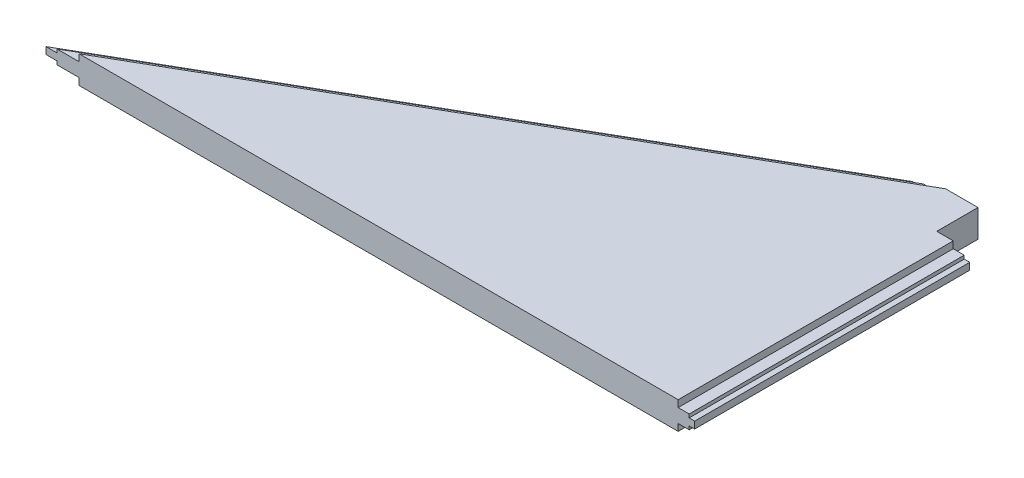
from build123d import *

# Parameters (mm, degrees)
BOSS_EXTRUDE1_DEPTH      = 6.35
BOSS_EXTRUDE1_DEPTH_BACK = 6.35
SKETCH2_W                = 292.995908675
SKETCH2_H                = 3.175
CUT_EXTRUDE1_DEPTH       = 38.1
SKETCH3_W                = 146.05
SKETCH3_H                = 3.175
CUT_EXTRUDE2_DEPTH       = 38.1
CUT_EXTRUDE3_DEPTH       = 3.175
CUT_EXTRUDE4_DEPTH       = 3.175
SKETCH6_W                = 5.08
SKETCH6_H                = 3.175
CUT_EXTRUDE5_DEPTH       = 157.099
CUT_EXTRUDE6_DEPTH       = 339.217
CUT_EXTRUDE6_DEPTH_BACK  = 157.099
SKETCH9_W                = 50.8
SKETCH9_H                = 19.05
CUT_EXTRUDE7_DEPTH       = 21.59


with BuildPart() as part:
    # Sketch1 → Boss-Extrude1 (new, two sides: drawn at the far end of the back side and taken through both)
    with BuildSketch(Plane(origin=(0, 0, 0), x_dir=(1, 0, 0), z_dir=(0, 1, 0)).offset(-BOSS_EXTRUDE1_DEPTH_BACK)):
        Polygon((-406.4, 0), (0, 0), (0, 146.05), (-152.4, 146.05), align=None)
    extrude(amount=BOSS_EXTRUDE1_DEPTH + BOSS_EXTRUDE1_DEPTH_BACK)

    # Sketch2 → Cut-Extrude1 (cut)
    with BuildSketch(Plane(origin=(-100.979614843, 0, -175.616721465), x_dir=(-0.8669063030575352, 0, 0.49847112425808277), z_dir=(-0.4984711242580827, 0, -0.8669063030575351))):
        with Locations((205.812767226, 4.7625)):
            Rectangle(SKETCH2_W, SKETCH2_H)
        with Locations((205.812767226, -4.7625)):
            Rectangle(SKETCH2_W, SKETCH2_H)
    extrude(amount=-CUT_EXTRUDE1_DEPTH, mode=Mode.SUBTRACT)

    # Sketch3 → Cut-Extrude2 (cut)
    with BuildSketch(Plane(origin=(0, 0, 0), x_dir=(0, 0, -1), z_dir=(1, 0, 0))):
        with Locations((73.025, 4.7625)):
            Rectangle(SKETCH3_W, SKETCH3_H)
        with Locations((73.025, -4.7625)):
            Rectangle(SKETCH3_W, SKETCH3_H)
    extrude(amount=-CUT_EXTRUDE2_DEPTH, mode=Mode.SUBTRACT)

    # Sketch4 → Cut-Extrude3 (cut)
    with BuildSketch(Plane(origin=(0, 6.35, 0), x_dir=(1, 0, 0), z_dir=(0, 1, 0))):
        Polygon((-133.408250166, 113.020869854), (-75.966284694, 146.05), (-152.4, 146.05), align=None)
    extrude(amount=-CUT_EXTRUDE3_DEPTH, mode=Mode.SUBTRACT)

    # Sketch5 → Cut-Extrude4 (cut)
    with BuildSketch(Plane.XZ.offset(6.35)):
        Polygon((-133.408250166, -113.020869854), (-75.966284694, -146.05), (-152.4, -146.05), align=None)
    extrude(amount=-CUT_EXTRUDE4_DEPTH, mode=Mode.SUBTRACT)

    # Sketch6 → Cut-Extrude5 (cut)
    with BuildSketch(Plane(origin=(0, 0, -146.05), x_dir=(-1, 0, 0), z_dir=(0, 0, -1))):
        Polygon((0, -3.175), (38.1, -3.175), (38.1, -1.5875), (35.56, -1.5875), (35.56, 1.5875), (38.1, 1.5875), (38.1, 3.175), (0, 3.175), align=None)
        with Locations((40.64, -4.7625)):
            Rectangle(SKETCH6_W, SKETCH6_H)
        with Locations((40.64, 4.7625)):
            Rectangle(SKETCH6_W, SKETCH6_H)
    extrude(amount=-CUT_EXTRUDE5_DEPTH, mode=Mode.SUBTRACT)

    # Sketch8 → Cut-Extrude6 (cut, two sides: drawn at the far end of the back side and taken through both)
    with BuildSketch(Plane(origin=(-51.420385157, 0, 29.566721465), x_dir=(0.49847112425808243, 0, 0.8669063030575355), z_dir=(-0.8669063030575355, 0, 0.49847112425808243)).offset(-CUT_EXTRUDE6_DEPTH_BACK)):
        Polygon((-164.478664898, 1.5875), (-164.478664898, 3.175), (-159.398664898, 3.175), (-159.398664898, 6.35), (-164.478664898, 6.35), (-202.578664898, 6.35), (-202.578664898, -6.35), (-164.478664898, -6.35), (-159.398664898, -6.35), (-159.398664898, -3.175), (-164.478664898, -3.175), (-164.478664898, -1.5875), (-167.018664898, -1.5875), (-167.018664898, 1.5875), align=None)
    extrude(amount=CUT_EXTRUDE6_DEPTH + CUT_EXTRUDE6_DEPTH_BACK, mode=Mode.SUBTRACT)

    # Sketch9 → Cut-Extrude7 (cut)
    with BuildSketch(Plane(origin=(0, 6.35, 0), x_dir=(1, 0, 0), z_dir=(0, 1, 0))):
        with Locations((-25.4, 136.525)):
            Rectangle(SKETCH9_W, SKETCH9_H)
    extrude(amount=-CUT_EXTRUDE7_DEPTH, mode=Mode.SUBTRACT)


solid = part.part
